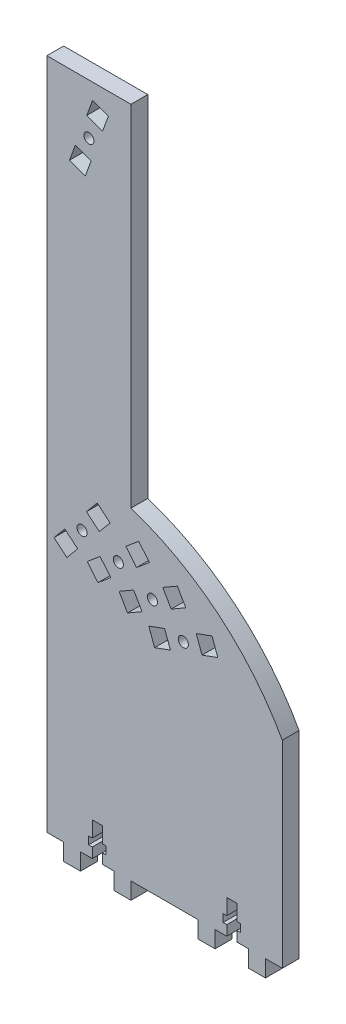
from build123d import *

# Parameters (mm, degrees)
ESQUISSE1_R        = 1.5
BOSS_EXTRU_1_DEPTH = 5


with BuildPart() as part:
    # Esquisse1 → Boss.-Extru.1 (new body)
    with BuildSketch(Plane.XY):
        with BuildLine():
            Line((-21.5, 0), (-25, 0))
            Line((-25, 0), (-25, -5))
            Line((-25, -5), (-30, -5))
            Line((-30, -5), (-30, 0))
            Line((-30, 0), (-35, 0))
            Line((-35, 0), (-35, 200))
            Line((-35, 200), (-10, 200))
            Line((-10, 200), (-10, 95.993420768))
            ThreePointArc((-10, 95.993420768), (16.02346259, 81.616607057), (35, 58.729833462))
            Line((35, 58.729833462), (35, 0))
            Line((35, 0), (30, 0))
            Line((30, 0), (30, -5))
            Line((30, -5), (25, -5))
            Line((25, -5), (25, 0))
            Line((25, 0), (21.5, 0))
            Line((21.5, 0), (21.5, 3))
            Line((21.5, 3), (22.6, 3))
            Line((22.6, 3), (22.6, 5.3))
            Line((22.6, 5.3), (21.5, 5.3))
            Line((21.5, 5.3), (21.5, 10))
            Line((21.5, 10), (18.5, 10))
            Line((18.5, 10), (18.5, 5.3))
            Line((18.5, 5.3), (17.4, 5.3))
            Line((17.4, 5.3), (17.4, 3))
            Line((17.4, 3), (18.5, 3))
            Line((18.5, 3), (18.5, 0))
            Line((18.5, 0), (15, 0))
            Line((15, 0), (15, -5))
            Line((15, -5), (10, -5))
            Line((10, -5), (10, 0))
            Line((10, 0), (-10, 0))
            Line((-10, 0), (-10, -5))
            Line((-10, -5), (-15, -5))
            Line((-15, -5), (-15, 0))
            Line((-15, 0), (-18.5, 0))
            Line((-18.5, 0), (-18.5, 3))
            Line((-18.5, 3), (-17.4, 3))
            Line((-17.4, 3), (-17.4, 5.3))
            Line((-17.4, 5.3), (-18.5, 5.3))
            Line((-18.5, 5.3), (-18.5, 10))
            Line((-18.5, 10), (-21.5, 10))
            Line((-21.5, 10), (-21.5, 5.3))
            Line((-21.5, 5.3), (-22.6, 5.3))
            Line((-22.6, 5.3), (-22.6, 3))
            Line((-22.6, 3), (-21.5, 3))
            Line((-21.5, 3), (-21.5, 0))
        make_face()
        with Locations((-24.543125869, 83.023041686)):
            Circle(ESQUISSE1_R, mode=Mode.SUBTRACT)
        with Locations((-13.758152943, 80.249762934)):
            Circle(ESQUISSE1_R, mode=Mode.SUBTRACT)
        with Locations((-3.618602792, 75.645825623)):
            Circle(ESQUISSE1_R, mode=Mode.SUBTRACT)
        with Locations((5.567439485, 69.351118058)):
            Circle(ESQUISSE1_R, mode=Mode.SUBTRACT)
        with Locations((-22.5, 185)):
            Circle(ESQUISSE1_R, mode=Mode.SUBTRACT)
        Polygon((-29.672175025, 80.799788495), (-32.886113073, 76.969566279), (-29.055890858, 73.755628231), (-25.841952809, 77.585850447), align=None, mode=Mode.SUBTRACT)
        Polygon((-23.244298928, 88.460232926), (-20.03036088, 92.290455142), (-16.200138664, 89.076517093), (-19.414076712, 85.246294878), align=None, mode=Mode.SUBTRACT)
        Polygon((-19.195344183, 78.950935993), (-23.025566399, 75.736997945), (-19.81162835, 71.906775729), (-15.981406135, 75.120713778), align=None, mode=Mode.SUBTRACT)
        Polygon((-11.534899752, 85.37881209), (-7.704677536, 88.592750139), (-4.490739488, 84.762527923), (-8.320961703, 81.548589875), align=None, mode=Mode.SUBTRACT)
        Polygon((-9.198729811, 75.310889132), (-13.52885683, 72.810889132), (-11.02885683, 68.480762114), (-6.698729811, 70.980762114), align=None, mode=Mode.SUBTRACT)
        Polygon((-0.538475773, 80.310889132), (3.791651246, 82.810889132), (6.291651246, 78.480762114), (1.961524227, 75.980762114), align=None, mode=Mode.SUBTRACT)
        Polygon((0.013926023, 69.990248894), (-4.684537081, 68.280148177), (-2.974436364, 63.581685073), (1.72402674, 65.29178579), align=None, mode=Mode.SUBTRACT)
        Polygon((9.410852231, 73.410450327), (14.109315335, 75.120551044), (15.819416051, 70.42208794), (11.120952947, 68.711987223), align=None, mode=Mode.SUBTRACT)
        Polygon((-26.559332269, 181.156587254), (-28.269432985, 176.45812415), (-23.570969881, 174.748023434), (-21.860869165, 179.446486538), align=None, mode=Mode.SUBTRACT)
        Polygon((-23.139130835, 190.553513462), (-21.429030119, 195.251976566), (-16.730567015, 193.54187585), (-18.440667731, 188.843412746), align=None, mode=Mode.SUBTRACT)
    extrude(amount=BOSS_EXTRU_1_DEPTH)


solid = part.part
